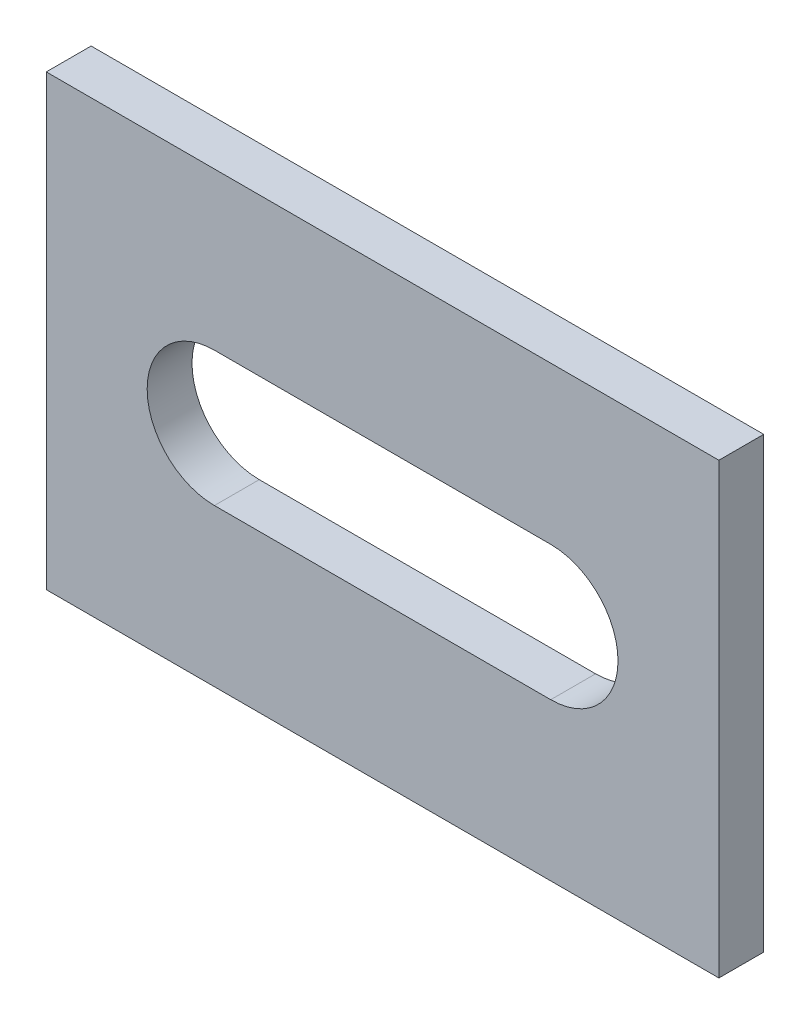
from build123d import *

# Parameters (mm, degrees)
SKETCH_1_W      = 30
SKETCH_1_H      = 20
EXTRUDE_1_DEPTH = 2


with BuildPart() as part:
    # ｽｹｯﾁ1 → ﾎﾞｽ - 押し出し1 (new body)
    with BuildSketch(Plane.XY):
        Rectangle(SKETCH_1_W, SKETCH_1_H)
        with BuildLine():
            Line((-7.5, 3), (7.5, 3))
            ThreePointArc((7.5, 3), (10.5, 0), (7.5, -3))
            Line((7.5, -3), (-7.5, -3))
            ThreePointArc((-7.5, -3), (-10.5, 0), (-7.5, 3))
        make_face(mode=Mode.SUBTRACT)
    extrude(amount=EXTRUDE_1_DEPTH)


solid = part.part
